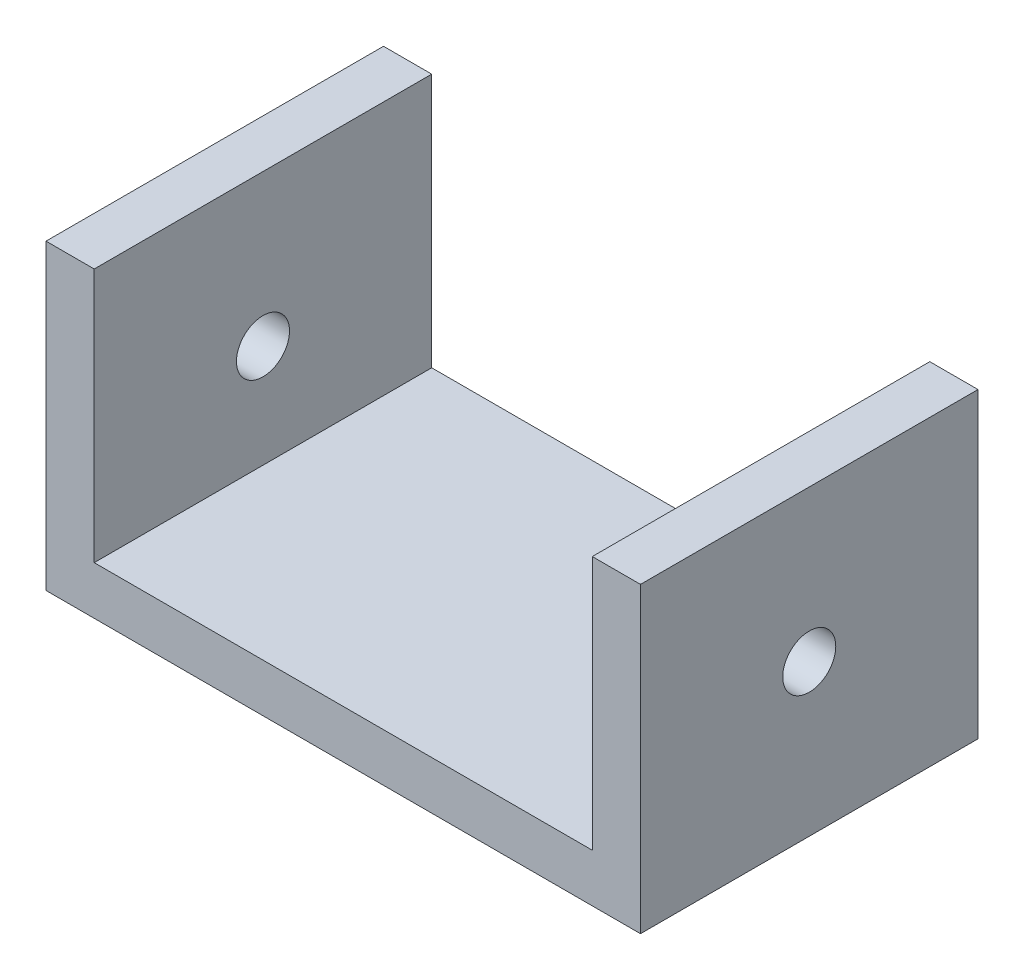
from build123d import *

# Parameters (mm, degrees)
SKETCH1_W           = 61.65
SKETCH1_H           = 31.375
BOSS_EXTRUDE1_DEPTH = 35
SKETCH2_W           = 51.65
SKETCH2_H           = 26.375
CUT_EXTRUDE1_DEPTH  = 50.206486171
SKETCH3_R           = 2.75
CUT_EXTRUDE2_DEPTH  = 73.607300984


with BuildPart() as part:
    # Sketch1 → Boss-Extrude1 (new body)
    with BuildSketch(Plane.XY):
        Rectangle(SKETCH1_W, SKETCH1_H)
    extrude(amount=BOSS_EXTRUDE1_DEPTH)

    # Sketch2 → Cut-Extrude1 (cut, through all)
    with BuildSketch(Plane(origin=(0, 0, 0), x_dir=(-1, 0, 0), z_dir=(0, 0, -1))):
        with Locations((0, 2.5)):
            Rectangle(SKETCH2_W, SKETCH2_H)
    extrude(amount=-CUT_EXTRUDE1_DEPTH, mode=Mode.SUBTRACT)

    # Sketch3 → Cut-Extrude2 (cut, through all)
    with BuildSketch(Plane(origin=(30.825, 0, 0), x_dir=(0, 0, -1), z_dir=(1, 0, 0))):
        with Locations((-17.5, 0)):
            Circle(SKETCH3_R)
    extrude(amount=-CUT_EXTRUDE2_DEPTH, mode=Mode.SUBTRACT)


solid = part.part
